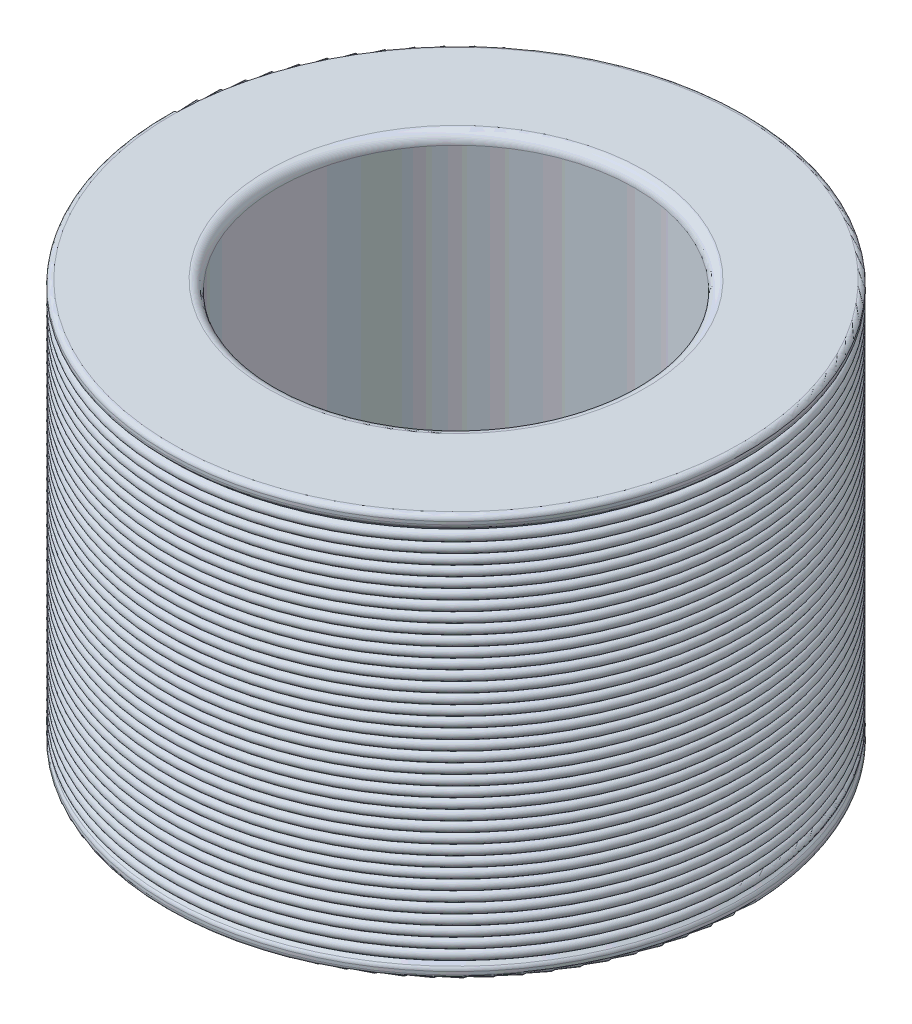
from build123d import *

# Parameters (mm, degrees)
FILLET1_R       = 0.2
FILLET2_R       = 0.1
LPATTERN1_COUNT = 37
LPATTERN1_PITCH = 0.2


with BuildPart() as part:
    # Sketch1 → Revolve1 (revolve)
    with BuildSketch(Plane(origin=(0, 0, 0), x_dir=(0, 0, -1), z_dir=(1, 0, 0)), mode=Mode.PRIVATE) as revolve1_sk:
        Polygon((3.55, 8), (5.75, 8), (5.75, 7.8), (5.65, 7.7), (5.5, 7.7), (5.5, 0.3), (5.65, 0.3), (5.75, 0.2), (5.75, 0), (3.55, 0), align=None)
    revolve(revolve1_sk.sketch.rotate(Axis((0, 11.134336509, 0), (0, -1, 0)), 180), axis=Axis((0, 11.134336509, 0), (0, -1, 0)))

    # Fillet1
    fillet1_edges = [part.edges().sort_by_distance(p)[0] for p in [
        (0, 8, -3.55),
        (0, 0, -3.55),
    ]]
    fillet(fillet1_edges, radius=FILLET1_R)

    # Fillet2
    fillet2_edges = [part.edges().sort_by_distance(p)[0] for p in [
        (0, 7.8, -5.75),
        (0, 8, -5.75),
        (0, 0, -5.75),
        (0, 0.2, -5.75),
    ]]
    fillet(fillet2_edges, radius=FILLET2_R)

    # Sketch2 → Revolve2 (revolve)
    with BuildSketch(Plane(origin=(0, 0, 0), x_dir=(0, 0, -1), z_dir=(1, 0, 0))):
        with BuildLine():
            Line((5.5, 7.7), (5.65, 7.7))
            ThreePointArc((5.65, 7.7), (5.75, 7.6), (5.65, 7.5))
            Line((5.65, 7.5), (5.5, 7.5))
            Line((5.5, 7.5), (5.5, 7.7))
        make_face()
    revolve2 = revolve(axis=Axis((0, 0, 0), (0, 1, 0)))

    # LPattern1: Revolve2 ×37
    with Locations(*[(0, -i * LPATTERN1_PITCH, 0) for i in range(1, LPATTERN1_COUNT)]):
        add(revolve2)


solid = part.part
